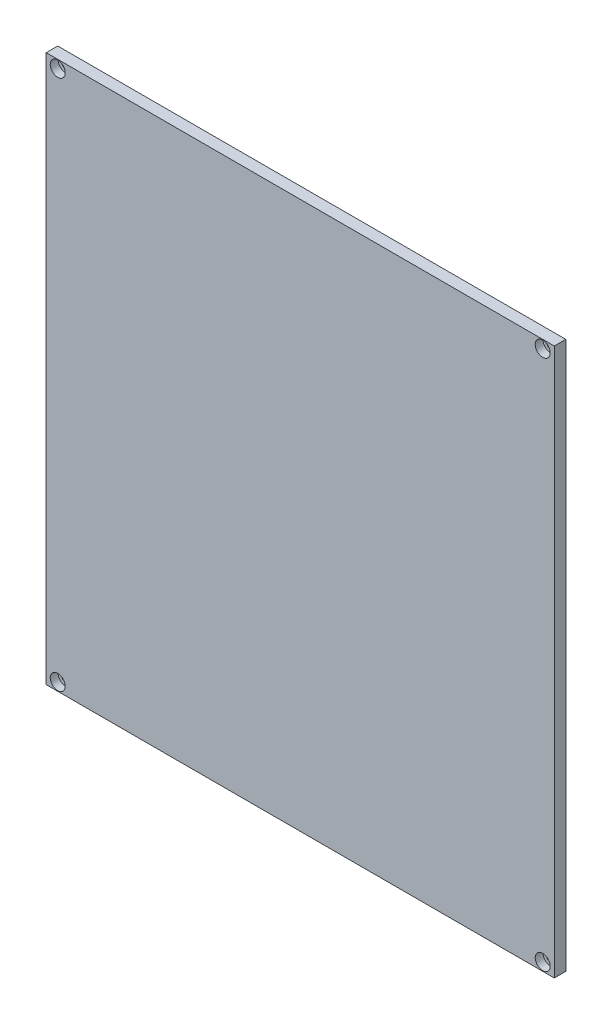
from build123d import *

# Parameters (mm, degrees)
SZKIC1_W                                            = 220
SZKIC1_H                                            = 237
DODANIE_WYCI_GNI_CIE1_DEPTH                         = 5
POG_BIENIE_WALCOWE_POD_M3_WKR_T_Z_BEM_W_D           = 3.6
POG_BIENIE_WALCOWE_POD_M3_WKR_T_Z_BEM_W_DEPTH       = 6.7
POG_BIENIE_WALCOWE_POD_M3_WKR_T_Z_BEM_W_CBORE_D     = 6.5
POG_BIENIE_WALCOWE_POD_M3_WKR_T_Z_BEM_W_CBORE_DEPTH = 3.4
POG_BIENIE_WALCOWE_POD_M3_WKR_T_Z_BEM_W_TIP         = 1.081549114


with BuildPart() as part:
    # Szkic1 → Dodanie-wyciągnięcie1 (new body)
    with BuildSketch(Plane.XY):
        Rectangle(SZKIC1_W, SZKIC1_H)
    extrude(amount=DODANIE_WYCI_GNI_CIE1_DEPTH)

    # Pogłębienie walcowe pod M3 Wkręt z łbem walcowym z gniazdem1
    with Locations(Plane.XY.offset(5)):
        with Locations((105, -115), (105, 115), (-105, 115), (-105, -115)):
            CounterBoreHole(POG_BIENIE_WALCOWE_POD_M3_WKR_T_Z_BEM_W_D / 2, POG_BIENIE_WALCOWE_POD_M3_WKR_T_Z_BEM_W_CBORE_D / 2, POG_BIENIE_WALCOWE_POD_M3_WKR_T_Z_BEM_W_CBORE_DEPTH, depth=POG_BIENIE_WALCOWE_POD_M3_WKR_T_Z_BEM_W_DEPTH)
            with Locations((0, 0, -(POG_BIENIE_WALCOWE_POD_M3_WKR_T_Z_BEM_W_DEPTH + POG_BIENIE_WALCOWE_POD_M3_WKR_T_Z_BEM_W_TIP / 2))):  # 118° drill point
                Cone(0, POG_BIENIE_WALCOWE_POD_M3_WKR_T_Z_BEM_W_D / 2, POG_BIENIE_WALCOWE_POD_M3_WKR_T_Z_BEM_W_TIP, mode=Mode.SUBTRACT)


solid = part.part
